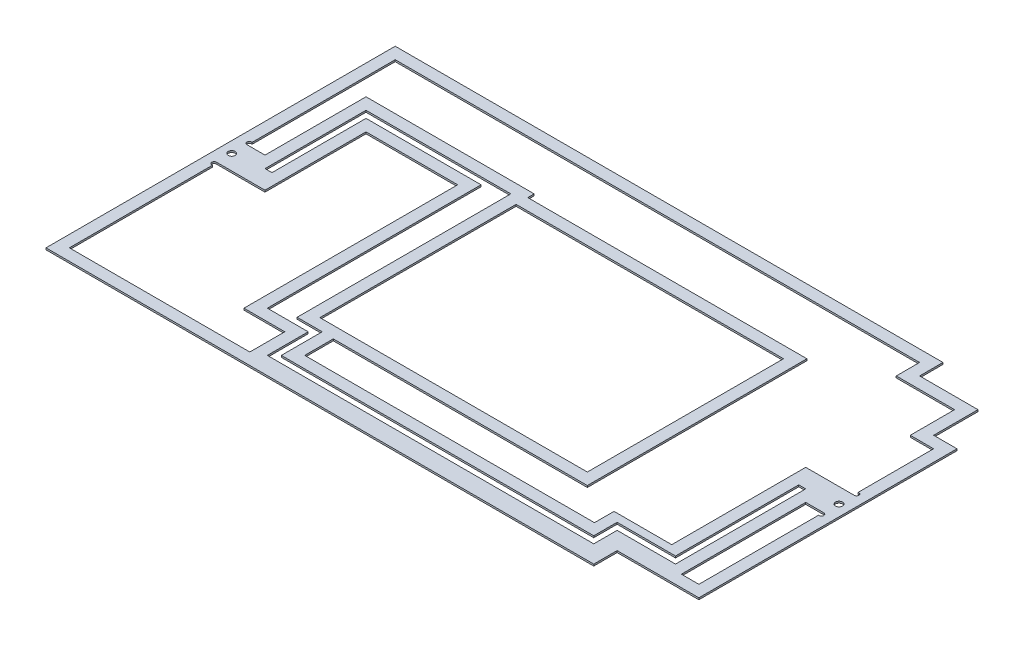
from build123d import *

# Parameters (mm, degrees)
SKETCH1_W           = 539
SKETCH1_H           = 299
BOSS_EXTRUDE1_DEPTH = 1.5
SKETCH10_W          = 70
SKETCH10_H          = 20
CUT_EXTRUDE6_DEPTH  = 309.192715683
SKETCH2_R           = 3
SKETCH2_R_2         = 2
CUT_EXTRUDE1_DEPTH  = 10
CUT_EXTRUDE3_DEPTH  = 309.192715683
CUT_EXTRUDE5_DEPTH  = 309.192715683
SKETCH7_W           = 15
SKETCH7_H           = 106.5
CUT_EXTRUDE4_DEPTH  = 309.192715683


with BuildPart() as part:
    # Sketch1 → Boss-Extrude1 (new body)
    with BuildSketch(Plane(origin=(0, 0, 0), x_dir=(1, 0, 0), z_dir=(0, 1, 0))):
        Rectangle(SKETCH1_W, SKETCH1_H)
    extrude(amount=-BOSS_EXTRUDE1_DEPTH)

    # Sketch10 → Cut-Extrude6 (cut, through all)
    with BuildSketch(Plane(origin=(0, 0, 0), x_dir=(1, 0, 0), z_dir=(0, 1, 0))):
        Polygon((269.5, 149.5), (199.5, 149.5), (199.5, 129.5), (249.5, 129.5), (249.5, 91.5), (269.5, 91.5), align=None)
        with Locations((234.5, -139.5)):
            Rectangle(SKETCH10_W, SKETCH10_H)
    extrude(amount=-CUT_EXTRUDE6_DEPTH, mode=Mode.SUBTRACT)

    # Sketch2 → Cut-Extrude1 (cut)
    with BuildSketch(Plane(origin=(0, 0, 0), x_dir=(1, 0, 0), z_dir=(0, 1, 0))):
        with Locations(Location((-260, 0, 0), (0, 0, 270))):
            Circle(SKETCH2_R)
        with Locations(Location((-260, 15, 0), (0, 0, 270))):
            Circle(SKETCH2_R_2)
        with Locations(Location((-260, -15, 0), (0, 0, 270))):
            Circle(SKETCH2_R_2)
    cut_extrude1 = extrude(amount=-CUT_EXTRUDE1_DEPTH, mode=Mode.SUBTRACT)

    # Mirror1: Cut-Extrude1 across plane
    add(cut_extrude1.mirror(Plane(origin=(0, 0, 0), x_dir=(0, 0, 1), z_dir=(1, 0, 0))), mode=Mode.SUBTRACT)

    # Sketch5 → Cut-Extrude3 (cut, through all)
    with BuildSketch(Plane(origin=(0, 0, 0), x_dir=(1, 0, 0), z_dir=(0, 1, 0))):
        Polygon((-100.5, -62.4), (-100.5, -84), (128.5, -84), (128.5, 84), (-100.5, 84), align=None)
    extrude(amount=-CUT_EXTRUDE3_DEPTH, mode=Mode.SUBTRACT)

    # Sketch9 → Cut-Extrude5 (cut, through all)
    with BuildSketch(Plane(origin=(0, 0, 0), x_dir=(1, 0, 0), z_dir=(0, 1, 0))):
        Polygon((-234.5, 3), (-228.5, 3), (-228.5, 83.5), (-130, 83.5), (-130, -99.5), (-95, -99.5), (-95, -134.5), (184.5, -134.5), (184.5, -114.5), (234.5, -114.5), (234.5, -3), (228.5, -3), (228.5, -108.5), (178.5, -108.5), (178.5, -128.5), (-89, -128.5), (-89, -93.5), (-110.5, -93.5), (-110.5, 89.5), (-234.5, 89.5), align=None)
    extrude(amount=-CUT_EXTRUDE5_DEPTH, mode=Mode.SUBTRACT)

    # Sketch7 → Cut-Extrude4 (cut, through all)
    with BuildSketch(Plane(origin=(0, 0, 0), x_dir=(1, 0, 0), z_dir=(0, 1, 0))):
        Polygon((-259.5, -13), (-218.5, -13), (-218.5, 73.5), (-140, 73.5), (-140, -109.5), (-105, -109.5), (-105, -139.5), (-140, -139.5), (-259.5, -139.5), align=None)
        Polygon((-259.5, 139.5), (-244.5, 139.5), (-100.5, 139.5), (189.5, 139.5), (189.5, 119.5), (239.5, 119.5), (239.5, 81.5), (259.5, 81.5), (259.5, 13), (218.5, 13), (218.5, -101.728673951), (169.107799643, -101.728673951), (169.107799643, -118.5), (-79, -118.5), (-79, -94), (138.5, -94), (138.5, 94), (-100.5, 94), (-100.5, 99.5), (-244.5, 99.5), (-244.5, 13), (-259.5, 13), align=None)
        with Locations((252, -66.25)):
            Rectangle(SKETCH7_W, SKETCH7_H)
    extrude(amount=-CUT_EXTRUDE4_DEPTH, mode=Mode.SUBTRACT)


solid = part.part
